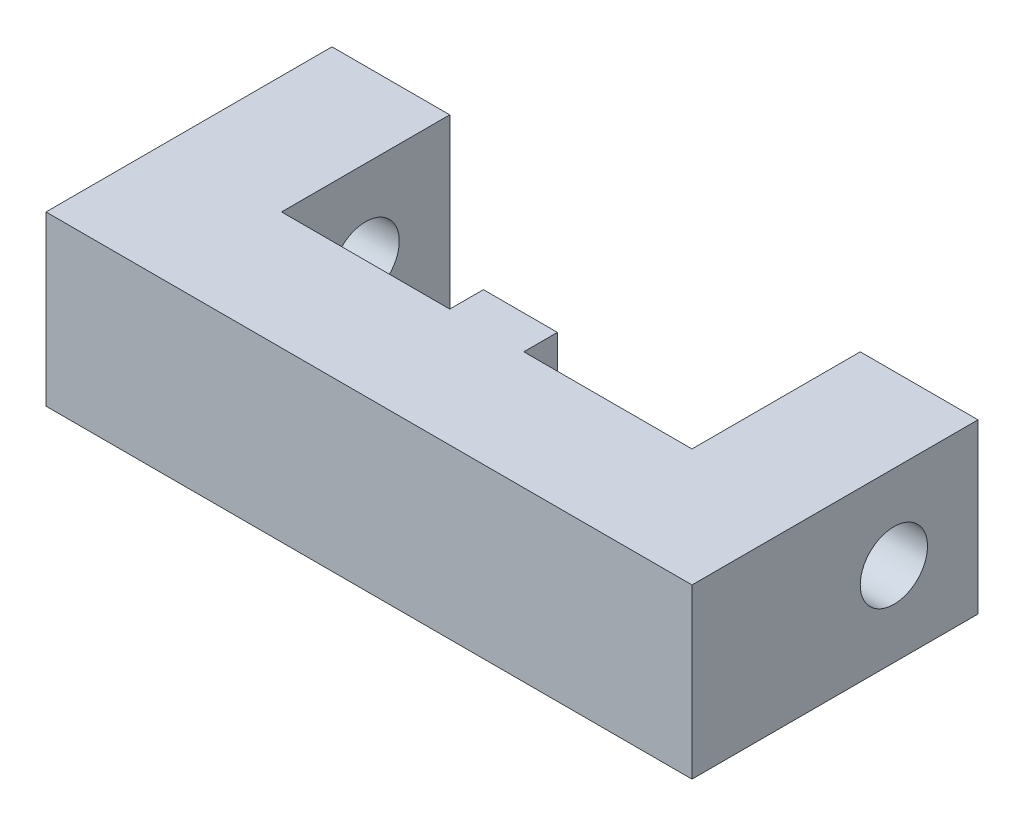
from build123d import *

# Parameters (mm, degrees)
BOSS_EXTRUDE1_DEPTH     = 12.7
CUT_EXTRUDE1_DEPTH      = 55.824592329
CUT_EXTRUDE1_DEPTH_BACK = 55.824592329
SKETCH3_R               = 2.54


with BuildPart() as part:
    # Sketch1 → Boss-Extrude1 (new body)
    with BuildSketch(Plane(origin=(0, 0, 0), x_dir=(1, 0, 0), z_dir=(0, 1, 0))):
        Polygon((0, 0), (24.384, 0), (24.384, 11.43), (21.59, 11.43), (21.59, 8.89), (8.89, 8.89), (8.89, 21.59), (0, 21.59), align=None)
    boss_extrude1 = extrude(amount=BOSS_EXTRUDE1_DEPTH)

    # Mirror1: Boss-Extrude1 across plane
    add(boss_extrude1.mirror(Plane(origin=(24.384, 12.7, -11.43), x_dir=(0, 0, 1), z_dir=(-1, 0, 0))))

    # Sketch3 → Cut-Extrude1 (cut, two sides: drawn at the far end of the back side and taken through both)
    with BuildSketch(Plane.ZY.offset(-CUT_EXTRUDE1_DEPTH_BACK)):
        with Locations((-15.24, 6.35)):
            Circle(SKETCH3_R)
    extrude(amount=CUT_EXTRUDE1_DEPTH + CUT_EXTRUDE1_DEPTH_BACK, mode=Mode.SUBTRACT)


solid = part.part
